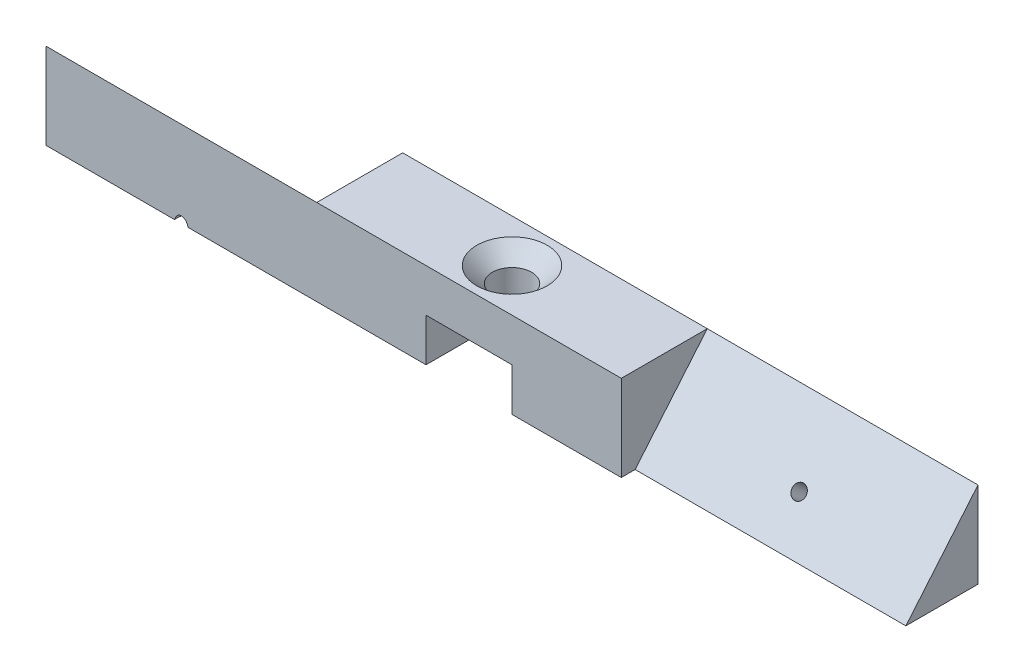
from build123d import *

# Parameters (mm, degrees)
SKETCH1_W                                       = 125
SKETCH1_H                                       = 12.7
BOSS_EXTRUDE1_DEPTH                             = 12.7
SKETCH2_W                                       = 12.7
SKETCH2_H                                       = 12.7
CUT_EXTRUDE1_DEPTH                              = 6.35
CSK_FOR_M5_FLAT_HEAD_MACHINE_SCREW1_D           = 5.8
CSK_FOR_M5_FLAT_HEAD_MACHINE_SCREW1_CSINK_D     = 10.4
CSK_FOR_M5_FLAT_HEAD_MACHINE_SCREW1_CSINK_ANGLE = 90
CUT_EXTRUDE2_DEPTH                              = 40
TAP_DRILL_FOR_M2_5X0_45_TAP1_D                  = 2.05
TAP_DRILL_FOR_M2_5X0_45_TAP1_DEPTH              = 8.164811475
CIRPATTERN1_COUNT                               = 2


with BuildPart() as part:
    # Sketch1 → Boss-Extrude1 (new body)
    with BuildSketch(Plane(origin=(0, 0, 0), x_dir=(1, 0, 0), z_dir=(0, 1, 0))):
        Rectangle(SKETCH1_W, SKETCH1_H)
    extrude(amount=BOSS_EXTRUDE1_DEPTH)

    # Sketch2 → Cut-Extrude1 (cut)
    with BuildSketch(Plane.XZ):
        Rectangle(SKETCH2_W, SKETCH2_H)
    extrude(amount=-CUT_EXTRUDE1_DEPTH, mode=Mode.SUBTRACT)

    # CSK for M5 Flat Head Machine Screw1 (through all)
    with Locations(Plane.ZX.offset(12.7)):
        with Locations((0, 0)):
            CounterSinkHole(CSK_FOR_M5_FLAT_HEAD_MACHINE_SCREW1_D / 2, CSK_FOR_M5_FLAT_HEAD_MACHINE_SCREW1_CSINK_D / 2, counter_sink_angle=CSK_FOR_M5_FLAT_HEAD_MACHINE_SCREW1_CSINK_ANGLE)

    # Sketch7 → Cut-Extrude2 (cut)
    with BuildSketch(Plane(origin=(62.5, 0, 0), x_dir=(0, 0, -1), z_dir=(1, 0, 0))):
        Polygon((6.35, 12.7), (-6.35, -2.435270626), (-6.35, 12.7), align=None)
    cut_extrude2 = extrude(amount=-CUT_EXTRUDE2_DEPTH, mode=Mode.SUBTRACT)

    # Tap Drill for M2.5x0.45 Tap1
    with Locations(Plane(origin=(42.5, 5.039555569, 0.077876097), x_dir=(0, 0.766044443119, -0.642787609687), z_dir=(0, 0.642787609687, 0.766044443119))):
        with Locations((0, 0)):
            tap_drill_for_m2_5x0_45_tap1 = Hole(TAP_DRILL_FOR_M2_5X0_45_TAP1_D / 2, depth=TAP_DRILL_FOR_M2_5X0_45_TAP1_DEPTH)

    # CirPattern1: Cut-Extrude2, Tap Drill for M2.5x0.45 Tap1 ×2 about axis
    cirpattern1_axis = Axis((0, 0, 0), (0, 1, 0))
    add([cut_extrude2.rotate(cirpattern1_axis, i * 360 / CIRPATTERN1_COUNT) for i in range(1, CIRPATTERN1_COUNT)], mode=Mode.SUBTRACT)
    add([tap_drill_for_m2_5x0_45_tap1.rotate(cirpattern1_axis, i * 360 / CIRPATTERN1_COUNT) for i in range(1, CIRPATTERN1_COUNT)], mode=Mode.SUBTRACT)


solid = part.part
